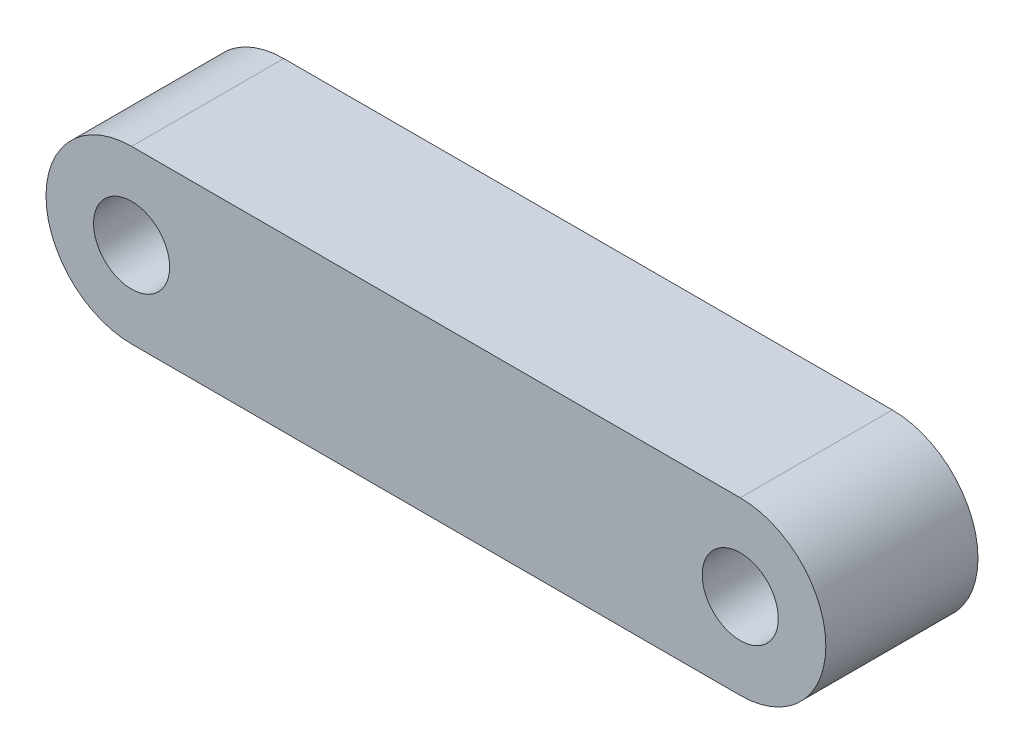
from build123d import *

# Parameters (mm, degrees)
ESQUISSE1_W             = 32
ESQUISSE1_H             = 9
BOSS_EXTRU_1_DEPTH      = 8
BOSS_EXTRU_2_DEPTH      = 8
ESQUISSE3_R             = 2
ENL_V_MAT_EXTRU_1_DEPTH = 39.435010082


with BuildPart() as part:
    # Esquisse1 → Boss.-Extru.1 (new body)
    with BuildSketch(Plane.XY):
        with Locations((16, 4.5)):
            Rectangle(ESQUISSE1_W, ESQUISSE1_H)
    extrude(amount=BOSS_EXTRU_1_DEPTH)

    # Esquisse2 → Boss.-Extru.2 (add)
    with BuildSketch(Plane.XY.offset(8)):
        with BuildLine():
            Line((0, 0), (0, 9))
            ThreePointArc((0, 9), (-4.5, 4.5), (0, 0))
        make_face()
        with BuildLine():
            Line((32, 0), (32, 9))
            ThreePointArc((32, 9), (36.5, 4.5), (32, 0))
        make_face()
    extrude(amount=-BOSS_EXTRU_2_DEPTH)

    # Esquisse3 → Enlèv. mat.-Extru.1 (cut, through all)
    with BuildSketch(Plane.XY.offset(8)):
        with Locations((32, 4.5)):
            Circle(ESQUISSE3_R)
        with Locations((0, 4.5)):
            Circle(ESQUISSE3_R)
    extrude(amount=-ENL_V_MAT_EXTRU_1_DEPTH, mode=Mode.SUBTRACT)


solid = part.part
